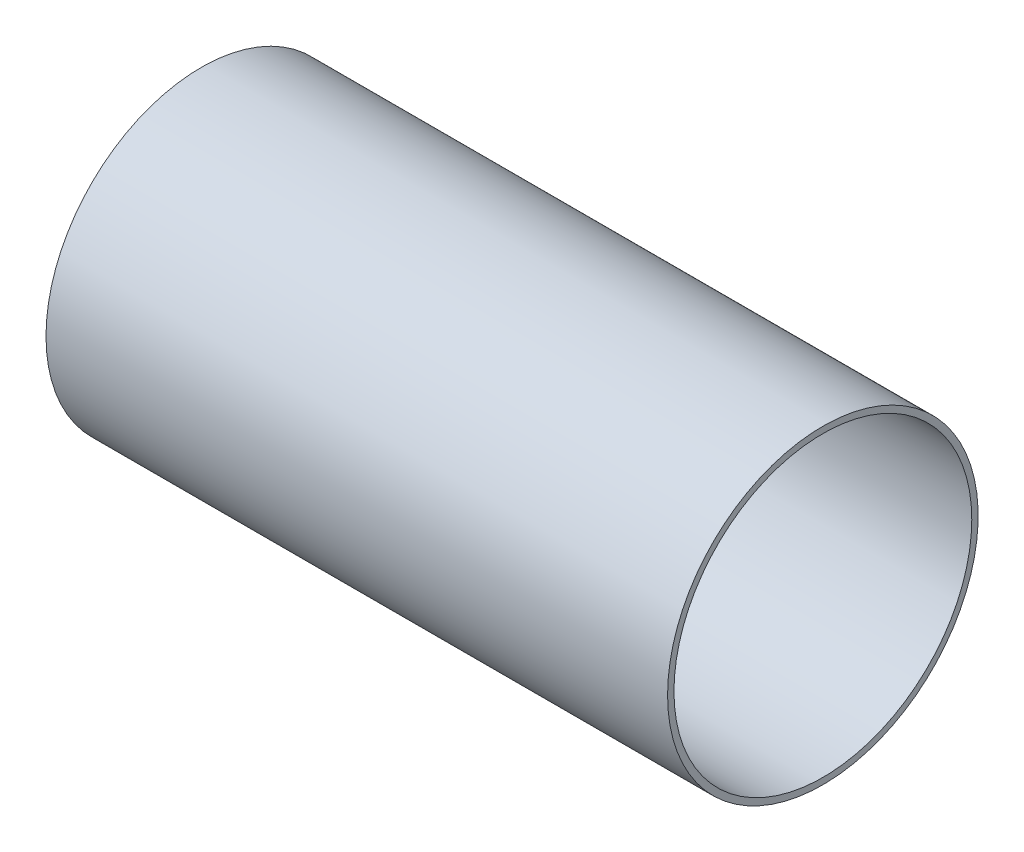
from build123d import *

# Parameters (mm, degrees)
SKETCH1_R           = 38.0746
SKETCH1_R_2         = 36.5125
BOSS_EXTRUDE1_DEPTH = 152.4


with BuildPart() as part:
    # Sketch1 → Boss-Extrude1 (new body)
    with BuildSketch(Plane.YZ):
        with Locations(Location((0, 0, 0), (0, 0, 90))):
            Circle(SKETCH1_R)
        with Locations(Location((0, 0, 0), (0, 0, 90))):
            Circle(SKETCH1_R_2, mode=Mode.SUBTRACT)
    extrude(amount=BOSS_EXTRUDE1_DEPTH)


solid = part.part
